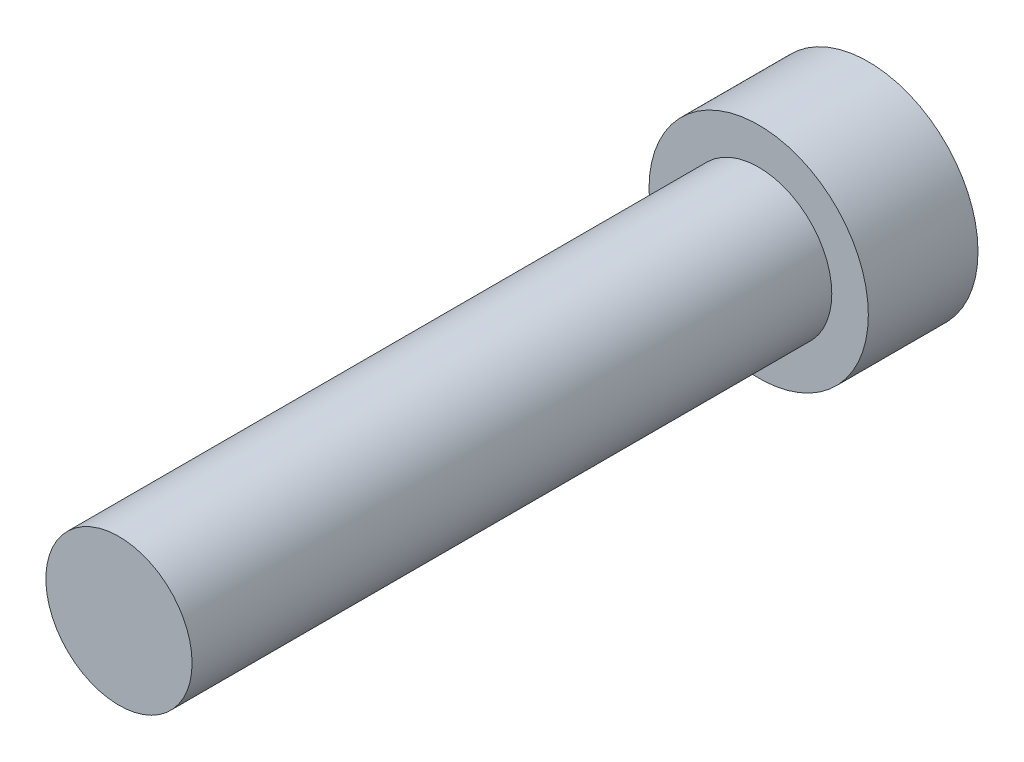
from build123d import *

# Parameters (mm, degrees)
SKETCH_1_R      = 6
EXTRUDE_1_DEPTH = 6
SKETCH_2_R      = 4
EXTRUDE_2_DEPTH = 35


with BuildPart() as part:
    # 草图1 → 凸台-拉伸1 (new body)
    with BuildSketch(Plane.XY):
        Circle(SKETCH_1_R)
        Polygon((3.464101615, 0), (1.732050808, 3), (-1.732050808, 3), (-3.464101615, 0), (-1.732050808, -3), (1.732050808, -3), align=None, mode=Mode.SUBTRACT)
    extrude(amount=EXTRUDE_1_DEPTH)

    # 草图2 → 凸台-拉伸2 (add)
    with BuildSketch(Plane.XY.offset(6)):
        Circle(SKETCH_2_R)
    extrude(amount=EXTRUDE_2_DEPTH)


solid = part.part
